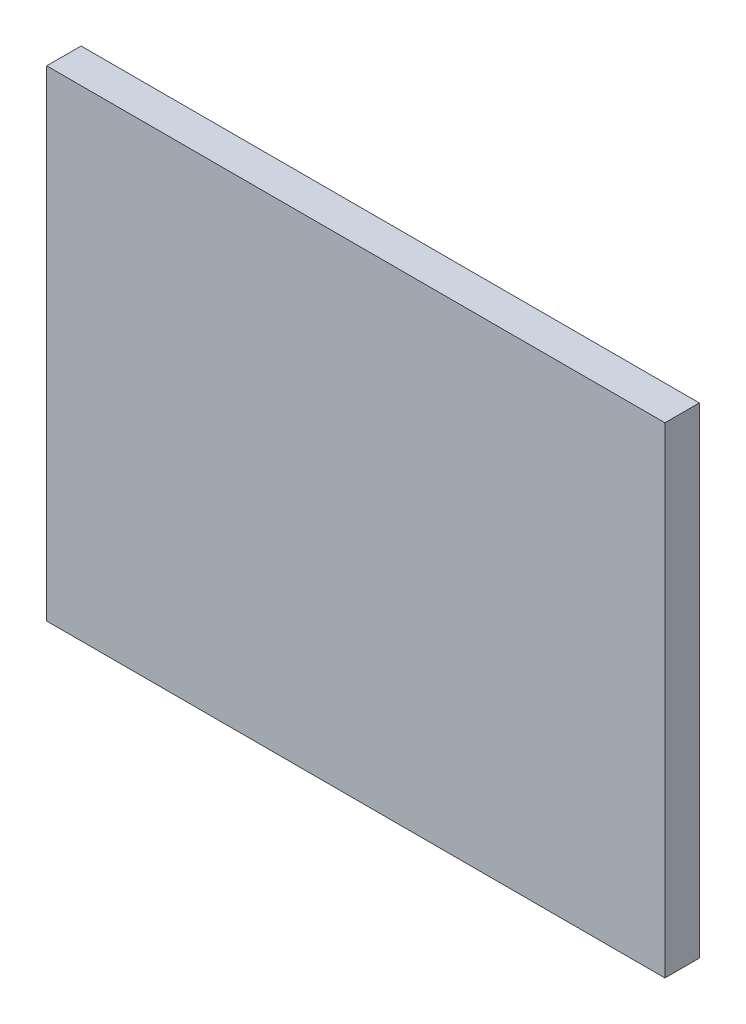
from build123d import *

# Parameters (mm, degrees)
SKETCH1_W           = 90
SKETCH1_H           = 70
BOSS_EXTRUDE1_DEPTH = 5


with BuildPart() as part:
    # Sketch1 → Boss-Extrude1 (new body)
    with BuildSketch(Plane.XY):
        Rectangle(SKETCH1_W, SKETCH1_H)
    extrude(amount=BOSS_EXTRUDE1_DEPTH)


solid = part.part
